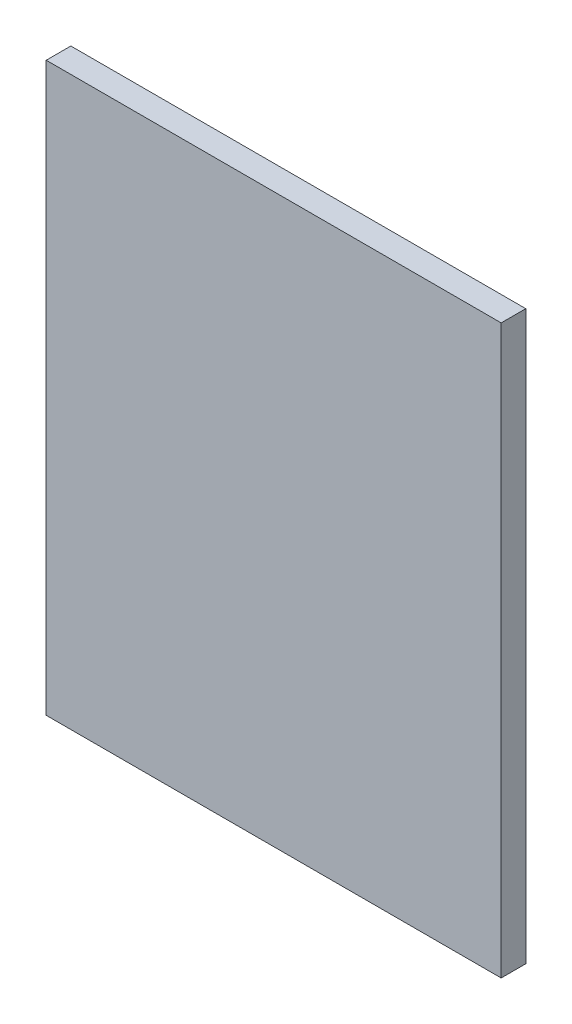
from build123d import *

# Parameters (mm, degrees)
CROQUIS1_W              = 42.5
CROQUIS1_H              = 53
SALIENTE_EXTRUIR1_DEPTH = 2.3


with BuildPart() as part:
    # Croquis1 → Saliente-Extruir1 (new body)
    with BuildSketch(Plane.XY):
        Rectangle(CROQUIS1_W, CROQUIS1_H)
    extrude(amount=SALIENTE_EXTRUIR1_DEPTH)


solid = part.part
